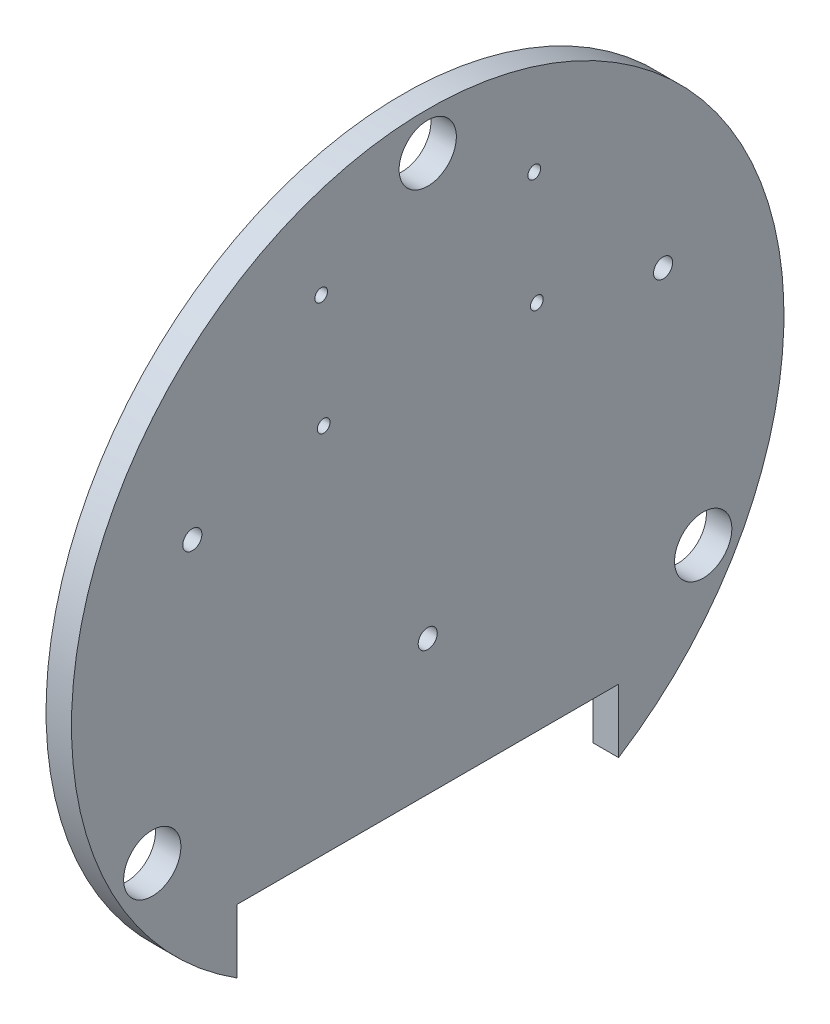
from build123d import *

# Parameters (mm, degrees)
SKETCH1_R           = 56
BOSS_EXTRUDE1_DEPTH = 4
SKETCH2_R           = 4.5
CUT_EXTRUDE1_DEPTH  = 80.296910406
CUT_EXTRUDE2_DEPTH  = 80.296910406
SKETCH4_R           = 1
SKETCH4_R_2         = 1.5
CUT_EXTRUDE3_DEPTH  = 80.296910406


with BuildPart() as part:
    # Sketch1 → Boss-Extrude1 (new body)
    with BuildSketch(Plane(origin=(0, 0, 0), x_dir=(0, 0, -1), z_dir=(1, 0, 0))):
        Circle(SKETCH1_R)
    extrude(amount=BOSS_EXTRUDE1_DEPTH)

    # Sketch2 → Cut-Extrude1 (cut, through all)
    with BuildSketch(Plane.ZY):
        with Locations((0, 50)):
            Circle(SKETCH2_R)
        with Locations((43.301270189, -25)):
            Circle(SKETCH2_R)
        with Locations((-43.301270189, -25)):
            Circle(SKETCH2_R)
    extrude(amount=-CUT_EXTRUDE1_DEPTH, mode=Mode.SUBTRACT)

    # Sketch3 → Cut-Extrude2 (cut, through all)
    with BuildSketch(Plane.ZY):
        with BuildLine():
            Line((-30, -47.28636167), (-30, -37.28636167))
            Line((-30, -37.28636167), (30, -37.28636167))
            Line((30, -37.28636167), (30, -47.28636167))
            ThreePointArc((30, -47.28636167), (0, -56), (-30, -47.28636167))
        make_face()
    extrude(amount=-CUT_EXTRUDE2_DEPTH, mode=Mode.SUBTRACT)

    # Sketch4 → Cut-Extrude3 (cut, through all)
    with BuildSketch(Plane(origin=(4, 0, 0), x_dir=(0, 0, -1), z_dir=(1, 0, 0))):
        with Locations((-16.75, 39.058710316)):
            Circle(SKETCH4_R)
        with Locations((16.75, 39.058710316)):
            Circle(SKETCH4_R)
        with Locations((17.152725495, 21.063216097)):
            Circle(SKETCH4_R)
        with Locations((-16.347274505, 21.063216097)):
            Circle(SKETCH4_R)
        with Locations((-37, 15.884372564)):
            Circle(SKETCH4_R_2)
        with Locations((0, -16.070778671)):
            Circle(SKETCH4_R_2)
        with Locations((37, 15.884372564)):
            Circle(SKETCH4_R_2)
    extrude(amount=-CUT_EXTRUDE3_DEPTH, mode=Mode.SUBTRACT)


solid = part.part
